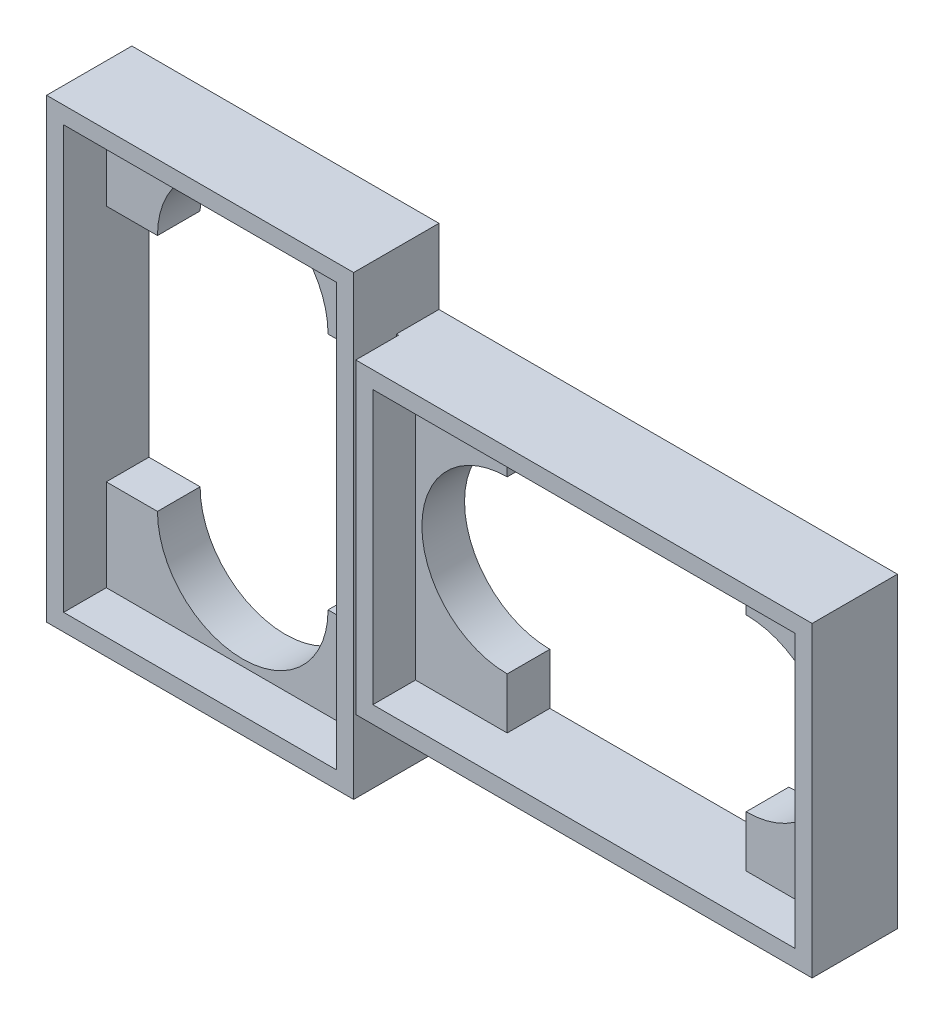
from build123d import *

# Parameters (mm, degrees)
SKETCH1_W           = 100
SKETCH1_H           = 55
BOSS_EXTRUDE1_DEPTH = 5
SKETCH2_W           = 36
SKETCH2_H           = 53.5
SKETCH2_W_2         = 32
SKETCH2_H_2         = 49.5
SKETCH2_W_3         = 53.5
SKETCH2_H_3         = 36
SKETCH2_W_4         = 49.5
SKETCH2_H_4         = 32
EXTRUDE_THIN3_DEPTH = 5
SKETCH3_W           = 10
SKETCH3_H           = 14
CUT_EXTRUDE1_DEPTH  = 5
SKETCH4_W           = 14
SKETCH4_H           = 10
CUT_EXTRUDE2_DEPTH  = 5
SKETCH5_W           = 6
SKETCH5_H           = 28
SKETCH5_W_2         = 28
SKETCH5_H_2         = 6
CUT_EXTRUDE3_DEPTH  = 5
CUT_EXTRUDE4_DEPTH  = 10
SKETCH7_W           = 3.25
SKETCH7_H           = 5
CUT_EXTRUDE5_DEPTH  = 10


with BuildPart() as part:
    # Sketch1 → Boss-Extrude1 (new body)
    with BuildSketch(Plane.XY):
        Rectangle(SKETCH1_W, SKETCH1_H)
    extrude(amount=BOSS_EXTRUDE1_DEPTH)

    # Sketch2 → Extrude-Thin3 (add)
    # profile 1 of 2: a face of its own
    with BuildSketch(Plane.XY.offset(5)):
        with Locations((-25, 0)):
            Rectangle(SKETCH2_W, SKETCH2_H)
        with Locations((-25, 0)):
            Rectangle(SKETCH2_W_2, SKETCH2_H_2, mode=Mode.SUBTRACT)
    # profile 2 of 2: a face of its own
    with BuildSketch(Plane.XY.offset(5)):
        with Locations((20, 0)):
            Rectangle(SKETCH2_W_3, SKETCH2_H_3)
        with Locations((20, 0)):
            Rectangle(SKETCH2_W_4, SKETCH2_H_4, mode=Mode.SUBTRACT)
    extrude(amount=EXTRUDE_THIN3_DEPTH)

    # Sketch3 → Cut-Extrude1 (cut)
    with BuildSketch(Plane.XY.offset(5)):
        with BuildLine():
            ThreePointArc((-25, 24), (-32.071067812, 21.071067812), (-35, 14))
            Line((-35, 14), (-25, 14))
            Line((-25, 14), (-25, 24))
        make_face()
        with BuildLine():
            Line((-25, 24), (-25, 14))
            Line((-25, 14), (-15, 14))
            ThreePointArc((-15, 14), (-17.928932188, 21.071067812), (-25, 24))
        make_face()
        with Locations((-30, 7)):
            Rectangle(SKETCH3_W, SKETCH3_H)
        with Locations((-20, 7)):
            Rectangle(SKETCH3_W, SKETCH3_H)
        with Locations((-20, -7)):
            Rectangle(SKETCH3_W, SKETCH3_H)
        with Locations((-30, -7)):
            Rectangle(SKETCH3_W, SKETCH3_H)
        with BuildLine():
            Line((-25, -14), (-35, -14))
            ThreePointArc((-35, -14), (-32.071067812, -21.071067812), (-25, -24))
            Line((-25, -24), (-25, -14))
        make_face()
        with BuildLine():
            Line((-15, -14), (-25, -14))
            Line((-25, -14), (-25, -24))
            ThreePointArc((-25, -24), (-17.928932188, -21.071067812), (-15, -14))
        make_face()
    extrude(amount=-CUT_EXTRUDE1_DEPTH, mode=Mode.SUBTRACT)

    # Sketch4 → Cut-Extrude2 (cut)
    with BuildSketch(Plane.XY.offset(5)):
        with Locations((13, 5)):
            Rectangle(SKETCH4_W, SKETCH4_H)
        with Locations((27, 5)):
            Rectangle(SKETCH4_W, SKETCH4_H)
        with Locations((27, -5)):
            Rectangle(SKETCH4_W, SKETCH4_H)
        with Locations((13, -5)):
            Rectangle(SKETCH4_W, SKETCH4_H)
        with BuildLine():
            Line((6, 0), (6, 10))
            ThreePointArc((6, 10), (-1.071067812, 7.071067812), (-4, 0))
            Line((-4, 0), (6, 0))
        make_face()
        with BuildLine():
            Line((6, -10), (6, 0))
            Line((6, 0), (-4, 0))
            ThreePointArc((-4, 0), (-1.071067812, -7.071067812), (6, -10))
        make_face()
        with BuildLine():
            ThreePointArc((44, 0), (41.071067812, 7.071067812), (34, 10))
            Line((34, 10), (34, 0))
            Line((34, 0), (44, 0))
        make_face()
        with BuildLine():
            Line((44, 0), (34, 0))
            Line((34, 0), (34, -10))
            ThreePointArc((34, -10), (41.071067812, -7.071067812), (44, 0))
        make_face()
    extrude(amount=-CUT_EXTRUDE2_DEPTH, mode=Mode.SUBTRACT)

    # Sketch5 → Cut-Extrude3 (cut)
    with BuildSketch(Plane.XY.offset(5)):
        with Locations((-12, 0)):
            Rectangle(SKETCH5_W, SKETCH5_H)
        with Locations((-38, 0)):
            Rectangle(SKETCH5_W, SKETCH5_H)
        with Locations((20, 13)):
            Rectangle(SKETCH5_W_2, SKETCH5_H_2)
        with Locations((20, -13)):
            Rectangle(SKETCH5_W_2, SKETCH5_H_2)
    extrude(amount=-CUT_EXTRUDE3_DEPTH, mode=Mode.SUBTRACT)

    # Sketch6 → Cut-Extrude4 (cut)
    with BuildSketch(Plane.XY.offset(5)):
        Polygon((-50, 27.5), (-50, -27.5), (50, -27.5), (50, -18), (-6.75, -18), (-6.75, -15.188993876), (-7, -15.188993876), (-7, -26.75), (-43, -26.75), (-43, 26.75), (-7, 26.75), (-7, 18), (46.75, 18), (46.75, -15.188993876), (50, -15.188993876), (50, 27.5), align=None)
    extrude(amount=-CUT_EXTRUDE4_DEPTH, mode=Mode.SUBTRACT)

    # Sketch7 → Cut-Extrude5 (cut)
    with BuildSketch(Plane(origin=(0, -15.188993876, 0), x_dir=(1, 0, 0), z_dir=(0, 1, 0))):
        with Locations((48.375, -2.5)):
            Rectangle(SKETCH7_W, SKETCH7_H)
    extrude(amount=-CUT_EXTRUDE5_DEPTH, mode=Mode.SUBTRACT)


solid = part.part
